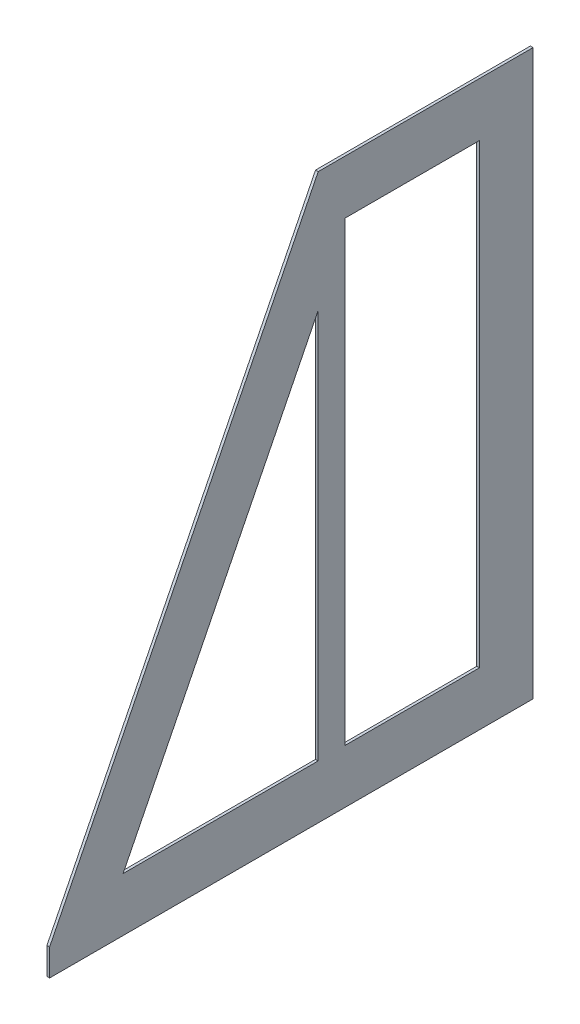
from build123d import *

# Parameters (mm, degrees)
SKETCH1_W           = 127
SKETCH1_H           = 431.8
BOSS_EXTRUDE1_DEPTH = 2.54


with BuildPart() as part:
    # Sketch1 → Boss-Extrude1 (new body)
    with BuildSketch(Plane(origin=(0, 0, 0), x_dir=(0, 0, -1), z_dir=(1, 0, 0))):
        Polygon((-67.465907198, 387.242597926), (135.734092802, 387.242597926), (135.734092802, -146.157402074), (-321.465907198, -146.157402074), (-321.465907198, -120.757402074), align=None)
        with Locations((21.434092802, 120.542597926)):
            Rectangle(SKETCH1_W, SKETCH1_H, mode=Mode.SUBTRACT)
        Polygon((-67.465907198, 273.650344669), (-251.969780569, -95.357402074), (-67.465907198, -95.357402074), align=None, mode=Mode.SUBTRACT)
    extrude(amount=BOSS_EXTRUDE1_DEPTH)


solid = part.part
